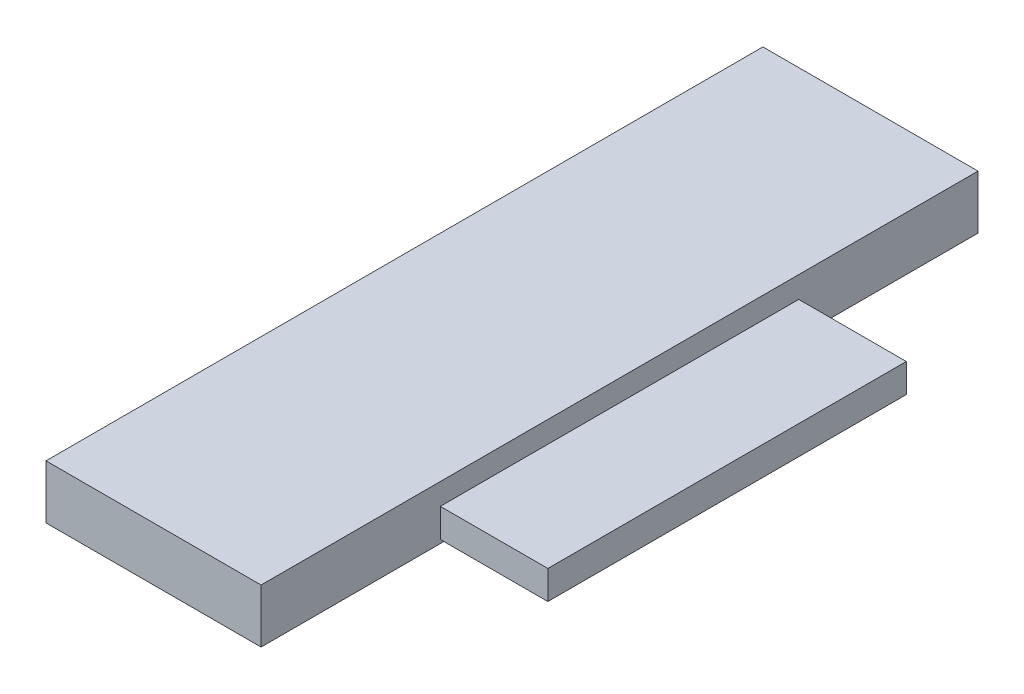
from build123d import *

# Parameters (mm, degrees)
SKETCH1_W           = 30
SKETCH1_H           = 100
BOSS_EXTRUDE1_DEPTH = 3.75
BOSS_EXTRUDE2_START = -3
SKETCH2_W           = 15
SKETCH2_H           = 50
BOSS_EXTRUDE2_DEPTH = 4


with BuildPart() as part:
    # Sketch1 → Boss-Extrude1 (new, symmetric)
    with BuildSketch(Plane(origin=(0, 0, 0), x_dir=(1, 0, 0), z_dir=(0, 1, 0))):
        with Locations((-15, 0)):
            Rectangle(SKETCH1_W, SKETCH1_H)
    extrude(amount=BOSS_EXTRUDE1_DEPTH, both=True)

    # Sketch2 → Boss-Extrude2 (add)
    with BuildSketch(Plane(origin=(0, 3.75, 0), x_dir=(1, 0, 0), z_dir=(0, 1, 0)).offset(BOSS_EXTRUDE2_START)):
        with Locations((7.5, 0)):
            Rectangle(SKETCH2_W, SKETCH2_H)
    extrude(amount=-BOSS_EXTRUDE2_DEPTH)


solid = part.part
